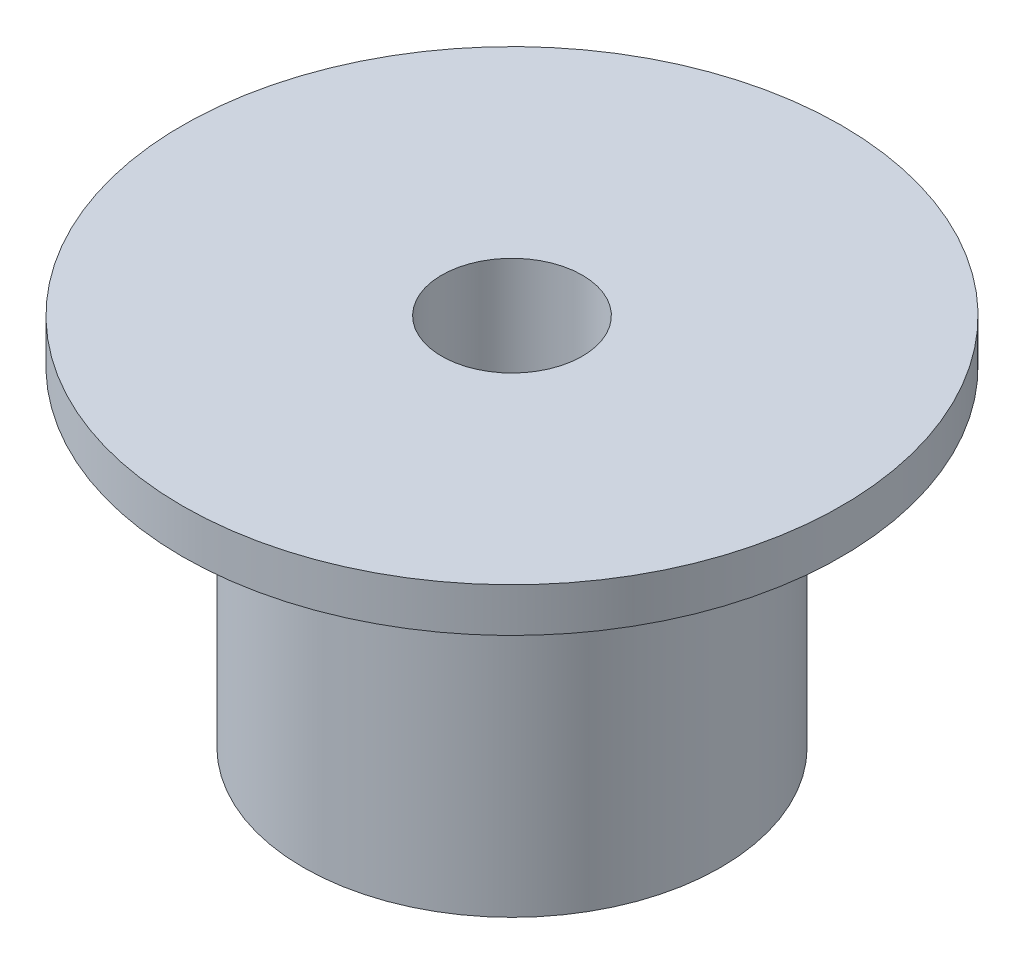
from build123d import *

# Parameters (mm, degrees)
SKETCH1_R           = 4.826
SKETCH1_R_2         = 1.6256
BOSS_EXTRUDE1_DEPTH = 7.62
SKETCH2_R           = 7.62
BOSS_EXTRUDE2_DEPTH = 1.016
SKETCH3_R           = 1.6256
CUT_EXTRUDE1_DEPTH  = 14.809753655


with BuildPart() as part:
    # Sketch1 → Boss-Extrude1 (new body)
    with BuildSketch(Plane(origin=(0, 0, 0), x_dir=(1, 0, 0), z_dir=(0, 1, 0))):
        with Locations(Location((0, 0, 0), (0, 0, 90))):
            Circle(SKETCH1_R)
        with Locations(Location((0, 0, 0), (0, 0, 90))):
            Circle(SKETCH1_R_2, mode=Mode.SUBTRACT)
    extrude(amount=BOSS_EXTRUDE1_DEPTH)

    # Sketch2 → Boss-Extrude2 (add)
    with BuildSketch(Plane(origin=(0, 7.62, 0), x_dir=(1, 0, 0), z_dir=(0, 1, 0))):
        with Locations(Location((0, 0, 0), (0, 0, 270))):
            Circle(SKETCH2_R)
    extrude(amount=BOSS_EXTRUDE2_DEPTH)

    # Sketch3 → Cut-Extrude1 (cut, through all)
    with BuildSketch(Plane.XZ):
        with Locations(Location((0, 0, 0), (0, 0, 270))):
            Circle(SKETCH3_R)
    extrude(amount=-CUT_EXTRUDE1_DEPTH, mode=Mode.SUBTRACT)


solid = part.part
